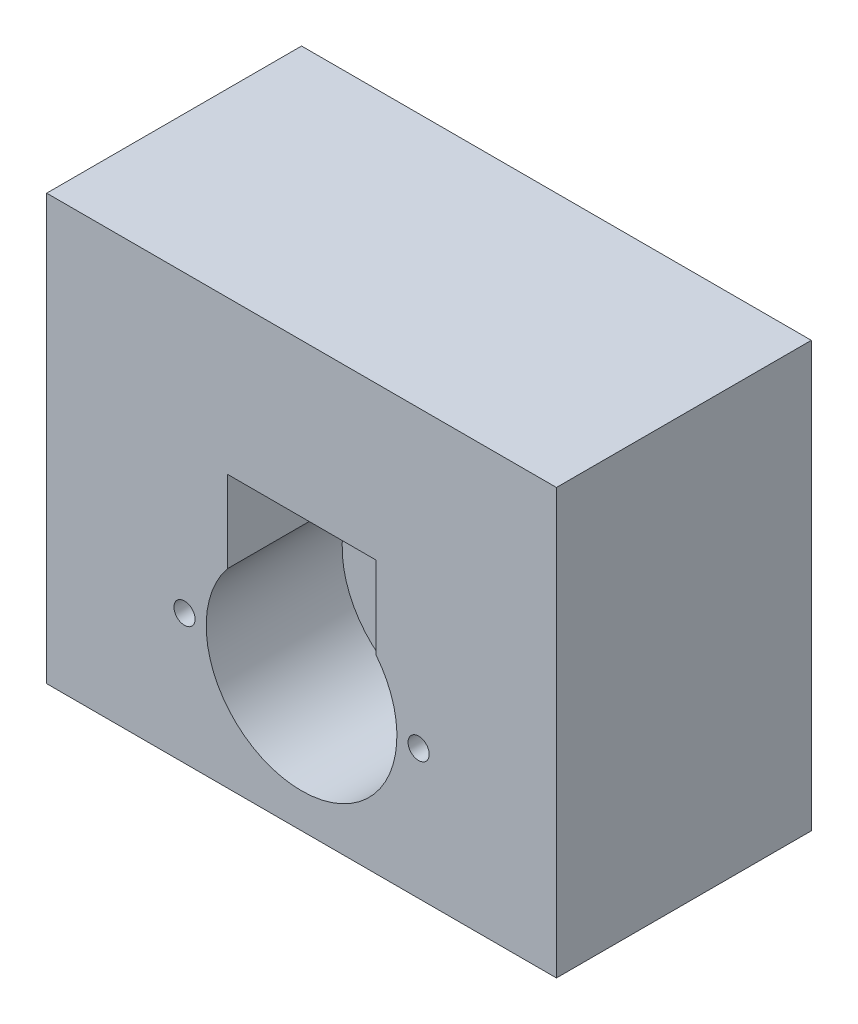
from build123d import *

# Parameters (mm, degrees)
SKETCH1_W           = 76.2
SKETCH1_H           = 63.5
BOSS_EXTRUDE1_DEPTH = 38.1
CUT_EXTRUDE2_DEPTH  = 20.32
SKETCH6_R           = 1.58
CUT_EXTRUDE3_DEPTH  = 20.32


with BuildPart() as part:
    # Sketch1 → Boss-Extrude1 (new body)
    with BuildSketch(Plane.XY):
        Rectangle(SKETCH1_W, SKETCH1_H)
    extrude(amount=BOSS_EXTRUDE1_DEPTH)

    # Sketch5 → Cut-Extrude2 (cut)
    with BuildSketch(Plane.XY.offset(38.1)):
        with BuildLine():
            Line((-11.095417071, -3.367534501), (-11.095417071, 8.870920326))
            Line((-11.095417071, 8.870920326), (11.095417071, 8.870920326))
            Line((11.095417071, 8.870920326), (11.095417071, -3.367534501))
            ThreePointArc((11.095417071, -3.367534501), (0, -26.569619951), (-11.095417071, -3.367534501))
        make_face()
    extrude(amount=-CUT_EXTRUDE2_DEPTH, mode=Mode.SUBTRACT)

    # Sketch6 → Cut-Extrude3 (cut)
    with BuildSketch(Plane.XY.offset(38.1)):
        with Locations((17.5, -12.315620011)):
            Circle(SKETCH6_R)
        with Locations((-17.5, -12.315620011)):
            Circle(SKETCH6_R)
    extrude(amount=-CUT_EXTRUDE3_DEPTH, mode=Mode.SUBTRACT)


solid = part.part
